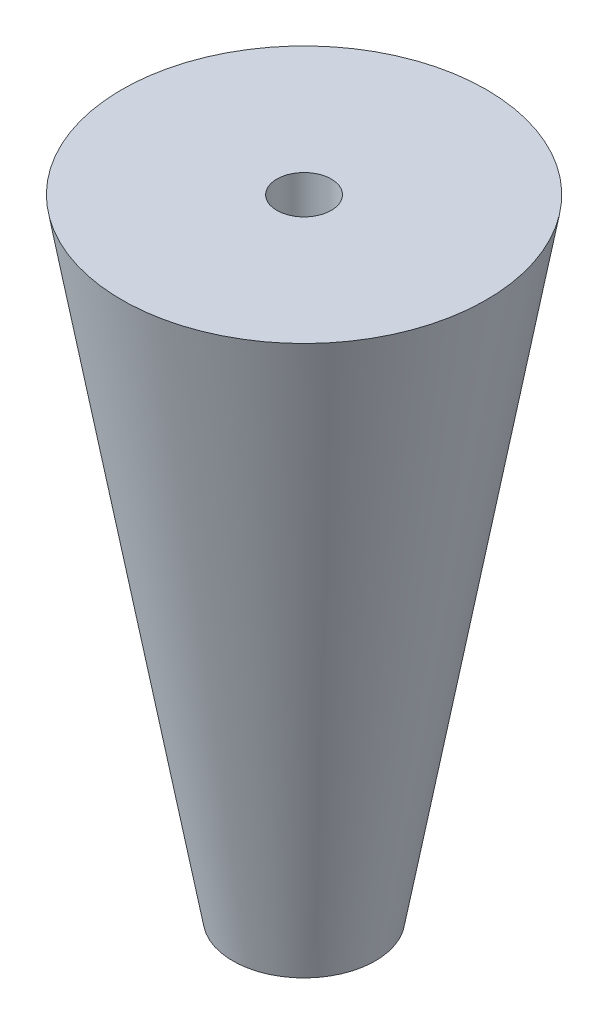
from build123d import *

# Parameters (mm, degrees)
SKETCH2_R          = 4.7625
CUT_EXTRUDE1_DEPTH = 188.370791745


with BuildPart() as part:
    # Sketch1 → Revolve1 (revolve)
    with BuildSketch(Plane.XY, mode=Mode.PRIVATE) as revolve1_sk:
        Polygon((116.442965696, 23.733016491), (116.442965696, 133.658487241), (84.540305415, 133.658487241), (103.959316021, 23.733016491), align=None)
    revolve(revolve1_sk.sketch.rotate(Axis((116.442965696, 23.733016491, 0), (0, 1, 0)), 270), axis=Axis((116.442965696, 23.733016491, 0), (0, 1, 0)))

    # Sketch2 → Cut-Extrude1 (cut, through all)
    with BuildSketch(Plane.XZ.offset(-23.733016491)):
        with Locations(Location((116.442965696, 0, 0), (0, 0, 270))):
            Circle(SKETCH2_R)
    extrude(amount=-CUT_EXTRUDE1_DEPTH, mode=Mode.SUBTRACT)


solid = part.part
